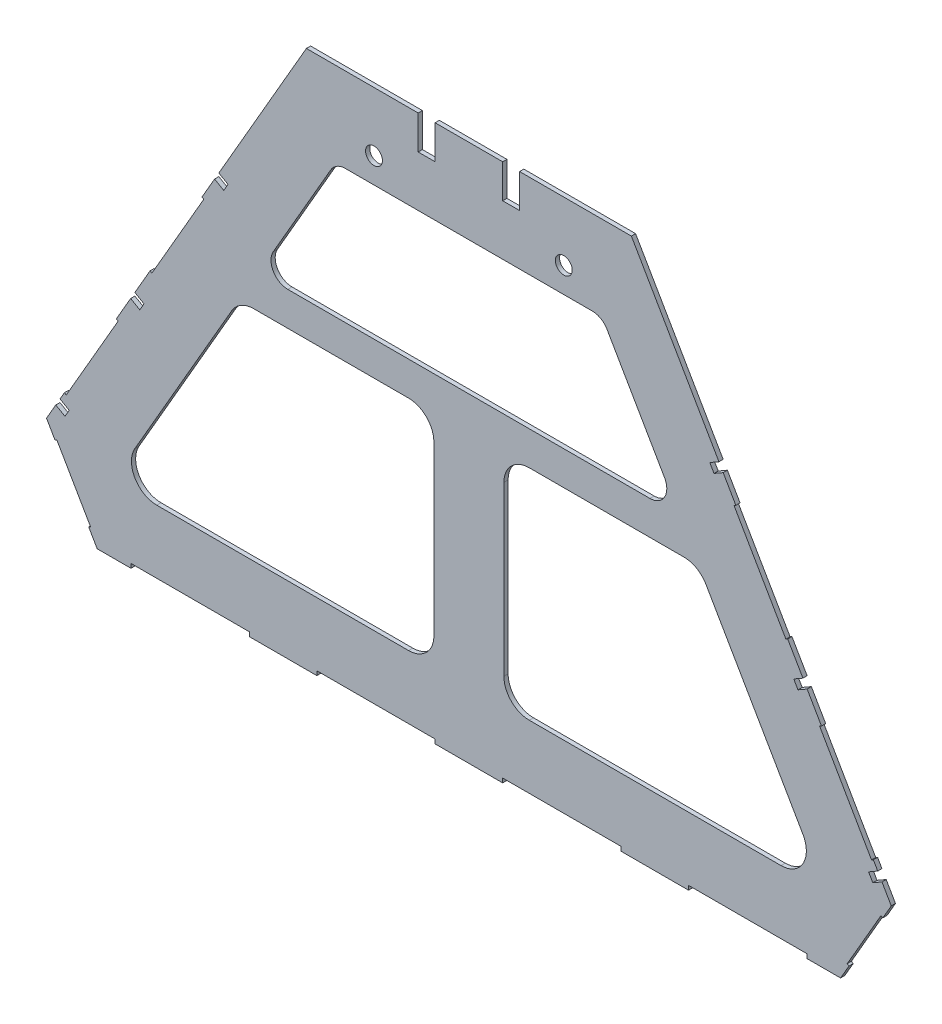
from build123d import *

# Parameters (mm, degrees)
BOSS_EXTRUDE1_DEPTH = 3.175
SKETCH8_W           = 12.7
SKETCH8_H           = 25.4
CUT_EXTRUDE1_DEPTH  = 515.13014894
SKETCH9_W           = 88.9
SKETCH9_H           = 3.175
CUT_EXTRUDE2_DEPTH  = 515.13014894
CUT_EXTRUDE3_DEPTH  = 515.13014894
CUT_EXTRUDE4_DEPTH  = 515.13014894
CUT_EXTRUDE5_DEPTH  = 515.13014894
CUT_EXTRUDE6_DEPTH  = 515.13014894
CUT_EXTRUDE7_DEPTH  = 515.13014894
SKETCH15_R          = 6.35
CUT_EXTRUDE8_DEPTH  = 515.13014894


with BuildPart() as part:
    # Sketch7 → Boss-Extrude1 (new body)
    with BuildSketch(Plane.XY):
        Polygon((279.4, 0), (-279.4, 0), (-317.5, 65.991135768), (-122.138026348, 404.368), (122.138026348, 404.368), (317.5, 65.991135768), align=None)
    extrude(amount=BOSS_EXTRUDE1_DEPTH)

    # Sketch8 → Cut-Extrude1 (cut, through all)
    with BuildSketch(Plane.XY.offset(3.175)):
        with Locations((-31.75, 391.668)):
            Rectangle(SKETCH8_W, SKETCH8_H)
        with Locations((31.75, 391.668)):
            Rectangle(SKETCH8_W, SKETCH8_H)
    extrude(amount=-CUT_EXTRUDE1_DEPTH, mode=Mode.SUBTRACT)

    # Sketch9 → Cut-Extrude2 (cut, through all)
    with BuildSketch(Plane.XY.offset(3.175)):
        with Locations((-209.55, 1.5875)):
            Rectangle(SKETCH9_W, SKETCH9_H)
        with Locations((-69.85, 1.5875)):
            Rectangle(SKETCH9_W, SKETCH9_H)
        with Locations((69.85, 1.5875)):
            Rectangle(SKETCH9_W, SKETCH9_H)
        with Locations((209.55, 1.5875)):
            Rectangle(SKETCH9_W, SKETCH9_H)
    extrude(amount=-CUT_EXTRUDE2_DEPTH, mode=Mode.SUBTRACT)

    # Sketch10 → Cut-Extrude3 (cut, through all)
    with BuildSketch(Plane.XY.offset(3.175)):
        Polygon((-311.15, 54.99261314), (-309.775184671, 55.78636314), (-284.375184671, 11.792272628), (-285.75, 10.998522628), align=None)
        Polygon((285.75, 10.998522628), (311.15, 54.99261314), (309.775184671, 55.78636314), (284.375184671, 11.792272628), align=None)
    extrude(amount=-CUT_EXTRUDE3_DEPTH, mode=Mode.SUBTRACT)

    # Sketch11 → Cut-Extrude4 (cut, through all)
    with BuildSketch(Plane.XY.offset(3.175)):
        Polygon((-304.038, 89.30800374), (-302.663184671, 88.51425374), (-263.674184671, 156.045182676), (-265.049, 156.838932676), align=None)
        Polygon((-238.274184671, 200.039273188), (-199.285184671, 267.570202125), (-200.66, 268.363952125), (-239.649, 200.833023188), align=None)
        Polygon((304.038, 89.30800374), (302.663184671, 88.51425374), (263.674184671, 156.045182676), (265.049, 156.838932676), align=None)
        Polygon((239.649, 200.833023188), (238.274184671, 200.039273188), (199.285184671, 267.570202125), (200.66, 268.363952125), align=None)
    extrude(amount=-CUT_EXTRUDE4_DEPTH, mode=Mode.SUBTRACT)

    # Sketch12 → Cut-Extrude5 (cut, through all)
    with BuildSketch(Plane.XY.offset(3.175)):
        Polygon((-254.254, 175.536421144), (-247.379923357, 171.567671144), (-244.204923357, 177.066932458), (-251.079, 181.035682458), align=None)
        Polygon((251.079, 181.035682458), (254.254, 175.536421144), (247.379923357, 171.567671144), (244.204923357, 177.066932458), align=None)
        Polygon((-310.515, 78.089510659), (-303.640923357, 74.120760659), (-300.465923357, 79.620021973), (-307.34, 83.588771973), align=None)
        Polygon((-191.135, 284.861736067), (-184.260923357, 280.892986067), (-181.085923357, 286.392247381), (-187.96, 290.360997381), align=None)
        Polygon((307.34, 83.588771973), (310.515, 78.089510659), (303.640923357, 74.120760659), (300.465923357, 79.620021973), align=None)
        Polygon((187.96, 290.360997381), (191.135, 284.861736067), (184.260923357, 280.892986067), (181.085923357, 286.392247381), align=None)
    extrude(amount=-CUT_EXTRUDE5_DEPTH, mode=Mode.SUBTRACT)

    # Sketch13 → Cut-Extrude6 (cut, through all)
    with BuildSketch(Plane.XY.offset(3.175)):
        with BuildLine():
            Line((-92.808632673, 340.868), (92.808632673, 340.868))
            ThreePointArc((92.808632673, 340.868), (99.158632673, 339.166522628), (103.807155302, 334.518))
            Line((103.807155302, 334.518), (147.068010972, 259.588))
            ThreePointArc((147.068010972, 259.588), (147.068010972, 246.888), (136.069488344, 240.538))
            Line((136.069488344, 240.538), (-136.069488344, 240.538))
            ThreePointArc((-136.069488344, 240.538), (-147.068010972, 246.888), (-147.068010972, 259.588))
            Line((-147.068010972, 259.588), (-103.807155302, 334.518))
            ThreePointArc((-103.807155302, 334.518), (-99.158632673, 339.166522628), (-92.808632673, 340.868))
        make_face()
    extrude(amount=-CUT_EXTRUDE6_DEPTH, mode=Mode.SUBTRACT)

    # Sketch14 → Cut-Extrude7 (cut, through all)
    with BuildSketch(Plane.XY.offset(3.175)):
        with BuildLine():
            Line((45.361818975, 215.138), (161.732707809, 215.138))
            ThreePointArc((161.732707809, 215.138), (171.257707809, 212.585783942), (178.230491751, 205.613))
            Line((178.230491751, 205.613), (251.114035033, 79.375))
            ThreePointArc((251.114035033, 79.375), (251.114035033, 60.325), (234.616251091, 50.8))
            Line((234.616251091, 50.8), (45.361818975, 50.8))
            ThreePointArc((45.361818975, 50.8), (31.891434794, 56.379615818), (26.311818975, 69.85))
            Line((26.311818975, 69.85), (26.311818975, 196.088))
            ThreePointArc((26.311818975, 196.088), (31.891434794, 209.558384182), (45.361818975, 215.138))
        make_face()
        with BuildLine():
            Line((-161.732707809, 215.138), (-45.361818975, 215.138))
            ThreePointArc((-45.361818975, 215.138), (-31.891434794, 209.558384182), (-26.311818975, 196.088))
            Line((-26.311818975, 196.088), (-26.311818975, 69.85))
            ThreePointArc((-26.311818975, 69.85), (-31.891434794, 56.379615818), (-45.361818975, 50.8))
            Line((-45.361818975, 50.8), (-234.616251091, 50.8))
            ThreePointArc((-234.616251091, 50.8), (-251.114035033, 60.325), (-251.114035033, 79.375))
            Line((-251.114035033, 79.375), (-178.230491751, 205.613))
            ThreePointArc((-178.230491751, 205.613), (-171.257707809, 212.585783942), (-161.732707809, 215.138))
        make_face()
    extrude(amount=-CUT_EXTRUDE7_DEPTH, mode=Mode.SUBTRACT)

    # Sketch15 → Cut-Extrude8 (cut, through all)
    with BuildSketch(Plane(origin=(0, 0, 0), x_dir=(-1, 0, 0), z_dir=(0, 0, -1))):
        with Locations((-71.338026348, 359.918)):
            Circle(SKETCH15_R)
        with Locations(Location((71.338026348, 359.918, 0), (0, 0, 180))):
            Circle(SKETCH15_R)
    extrude(amount=-CUT_EXTRUDE8_DEPTH, mode=Mode.SUBTRACT)


solid = part.part
